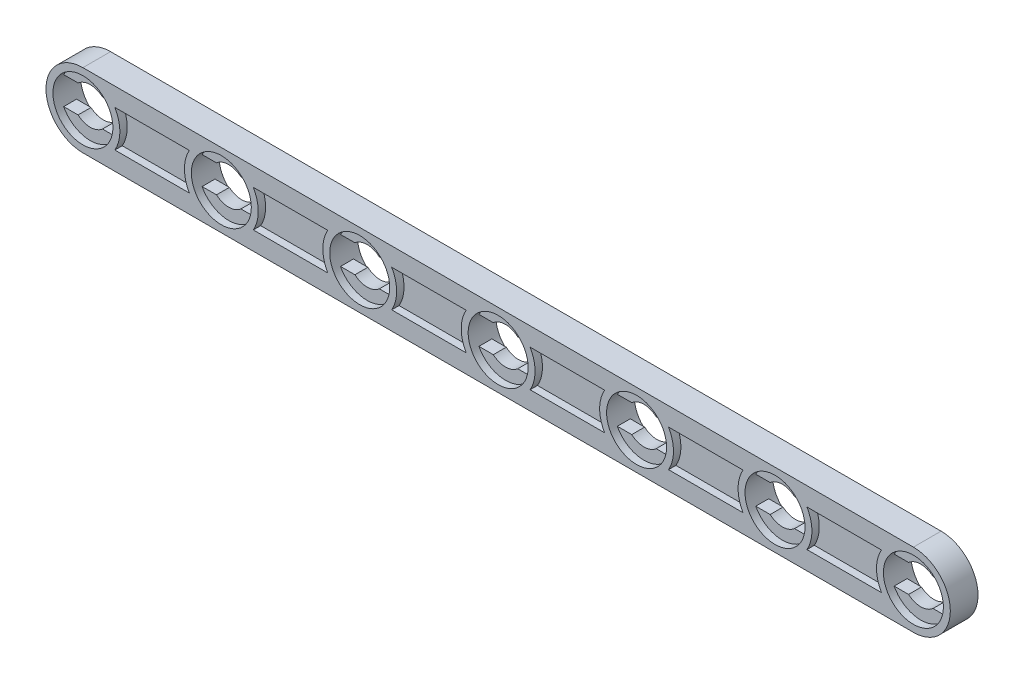
from build123d import *

# Parameters (mm, degrees)
EXTRUDE_1_DEPTH        = 3
CUT_EXTRUDE_1_REACH    = 96.133
SKETCH_3_R             = 3.25
CUT_EXTRUDE_2_DEPTH    = 0.8
CUT_EXTRUDE_START      = -2.2
SKETCH_3_2_R           = 3.25
CUT_EXTRUDE_3_DEPTH    = 0.8
CUT_EXTRUDE_4_DEPTH    = 0.8
SKETCH_5_W             = 7
SKETCH_5_H             = 4
CUT_EXTRUDE_6_DEPTH    = 0.8
PATTERN_LINEAR_1_COUNT = 7
PATTERN_LINEAR_1_PITCH = 15
PATTERN_LINEAR_2_COUNT = 6
PATTERN_LINEAR_2_PITCH = 15


with BuildPart() as part:
    # 草图1 → 凸台-拉伸1 (new body)
    with BuildSketch(Plane.XY):
        with BuildLine():
            Line((0, 4), (90, 4))
            ThreePointArc((90, 4), (94, 0), (90, -4))
            Line((90, -4), (0, -4))
            ThreePointArc((0, -4), (-4, 0), (0, 4))
        make_face()
    extrude(amount=-EXTRUDE_1_DEPTH)

    # 草图2 → 切除-拉伸1 (cut, up to next)
    with BuildSketch(Plane.XY, mode=Mode.PRIVATE) as cut_extrude_1_sk1:
        with BuildLine():
            Line((1.322875656, -1.5), (2.883140649, -1.5))
            ThreePointArc((2.883140649, -1.5), (3.25, 0), (2.883140649, 1.5))
            Line((2.883140649, 1.5), (1.322875656, 1.5))
            ThreePointArc((1.322875656, 1.5), (0, 2), (-1.322875656, 1.5))
            Line((-1.322875656, 1.5), (-2.883140649, 1.5))
            ThreePointArc((-2.883140649, 1.5), (-3.25, 0), (-2.883140649, -1.5))
            Line((-2.883140649, -1.5), (-1.322875656, -1.5))
            ThreePointArc((-1.322875656, -1.5), (0, -2), (1.322875656, -1.5))
        make_face()
    cut_extrude_1_tool1 = extrude(cut_extrude_1_sk1.sketch, amount=-CUT_EXTRUDE_1_REACH, mode=Mode.PRIVATE) & part.part
    cut_extrude_1 = cut_extrude_1_tool1.solids().sort_by_distance((0, 0, 0))[0]
    add(cut_extrude_1, mode=Mode.SUBTRACT)

    # 草图3 → 切除-拉伸2 (cut)
    with BuildSketch(Plane.XY):
        Circle(SKETCH_3_R)
    cut_extrude_2 = extrude(amount=-CUT_EXTRUDE_2_DEPTH, mode=Mode.SUBTRACT)

    # 草图3<2> → 切除-拉伸3 (cut)
    with BuildSketch(Plane.XY.offset(CUT_EXTRUDE_START)):
        Circle(SKETCH_3_2_R)
    cut_extrude_3 = extrude(amount=-CUT_EXTRUDE_3_DEPTH, mode=Mode.SUBTRACT)

    # 草图4 → 切除-拉伸4 (cut)
    with BuildSketch(Plane.XY):
        with BuildLine():
            Line((3.464101615, 2), (11.535898385, 2))
            ThreePointArc((11.535898385, 2), (11, 0), (11.535898385, -2))
            Line((11.535898385, -2), (3.464101615, -2))
            ThreePointArc((3.464101615, -2), (4, 0), (3.464101615, 2))
        make_face()
    cut_extrude_4 = extrude(amount=-CUT_EXTRUDE_4_DEPTH, mode=Mode.SUBTRACT)

    # 草图5 → 切除-拉伸6 (cut)
    with BuildSketch(Plane(origin=(0, 0, -3), x_dir=(-1, 0, 0), z_dir=(0, 0, -1))):
        with Locations((-7.5, 0)):
            Rectangle(SKETCH_5_W, SKETCH_5_H)
    cut_extrude_6 = extrude(amount=-CUT_EXTRUDE_6_DEPTH, mode=Mode.SUBTRACT)

    # 阵列(线性)1: 切除-拉伸1, 切除-拉伸2, 切除-拉伸3 ×7
    with Locations(*[(i * PATTERN_LINEAR_1_PITCH, 0, 0) for i in range(1, PATTERN_LINEAR_1_COUNT)]):
        add(cut_extrude_1, mode=Mode.SUBTRACT)
        add(cut_extrude_2, mode=Mode.SUBTRACT)
        add(cut_extrude_3, mode=Mode.SUBTRACT)

    # 阵列(线性)2: 切除-拉伸4, 切除-拉伸6 ×6
    with Locations(*[(i * PATTERN_LINEAR_2_PITCH, 0, 0) for i in range(1, PATTERN_LINEAR_2_COUNT)]):
        add(cut_extrude_4, mode=Mode.SUBTRACT)
        add(cut_extrude_6, mode=Mode.SUBTRACT)


solid = part.part
